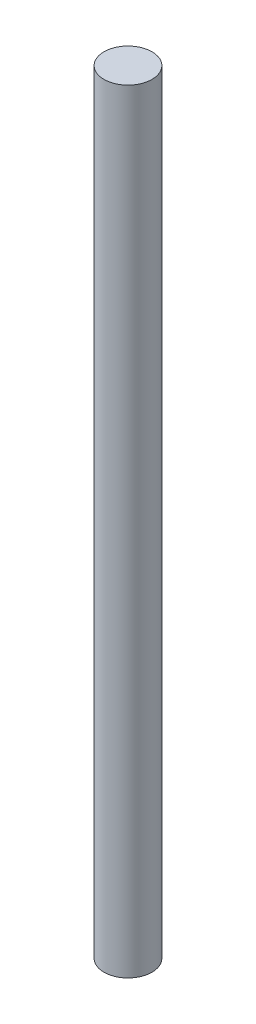
from build123d import *

# Parameters (mm, degrees)
SKETCH1_R           = 1.55
BOSS_EXTRUDE1_DEPTH = 50


with BuildPart() as part:
    # Sketch1 → Boss-Extrude1 (new body)
    with BuildSketch(Plane(origin=(0, 0, 0), x_dir=(1, 0, 0), z_dir=(0, 1, 0))):
        with Locations(Location((0, 0, 0), (0, 0, 270))):
            Circle(SKETCH1_R)
    extrude(amount=BOSS_EXTRUDE1_DEPTH)


solid = part.part
